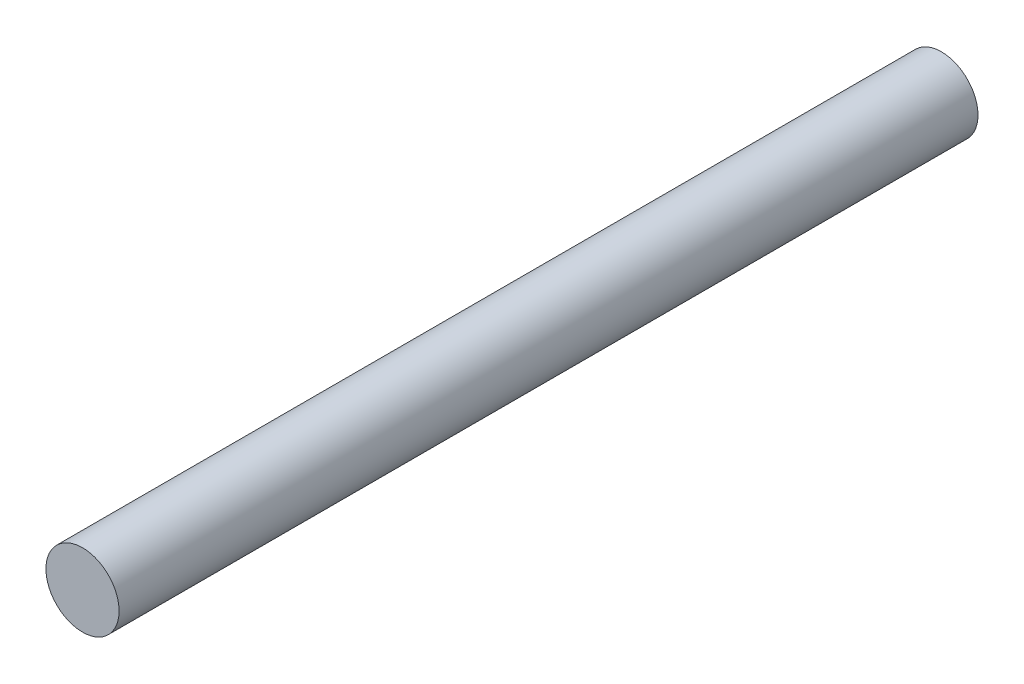
from build123d import *

# Parameters (mm, degrees)
SKETCH1_R           = 1.8923
BOSS_EXTRUDE1_DEPTH = 44.45


with BuildPart() as part:
    # Sketch1 → Boss-Extrude1 (new body)
    with BuildSketch(Plane.XY):
        Circle(SKETCH1_R)
    extrude(amount=BOSS_EXTRUDE1_DEPTH)


solid = part.part
